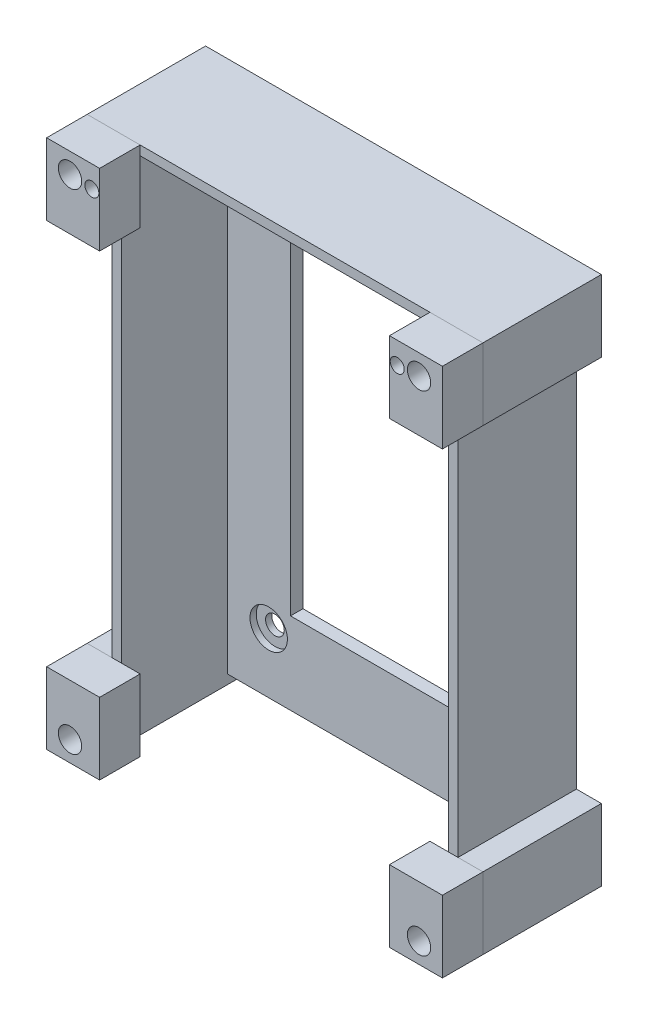
from build123d import *

# Parameters (mm, degrees)
SKETCH1_W           = 52.5
SKETCH1_H           = 82
SKETCH1_R           = 3
SKETCH1_W_2         = 32.25
SKETCH1_H_2         = 55.75
BOSS_EXTRUDE1_DEPTH = 2
SKETCH1_6_R         = 3
SKETCH1_6_R_2       = 1.5
BOSS_EXTRUDE4_DEPTH = 1
BOSS_EXTRUDE2_DEPTH = 19
BOSS_EXTRUDE3_START = 19
SKETCH1_5_W         = 3
SKETCH1_5_H         = 10
SKETCH1_5_H_2       = 1.5
SKETCH1_5_W_2       = 4
SKETCH1_5_H_3       = 11.5
BOSS_EXTRUDE3_DEPTH = 6.5
SKETCH7_R           = 1.125
SKETCH7_R_2         = 1.875
CUT_EXTRUDE6_DEPTH  = 4


with BuildPart() as part:
    # Sketch1 → Boss-Extrude1 (new body)
    with BuildSketch(Plane.XY):
        Rectangle(SKETCH1_W, SKETCH1_H)
        with Locations((19.625, 31.375)):
            Circle(SKETCH1_R, mode=Mode.SUBTRACT)
        with Locations((-19.625, 31.375)):
            Circle(SKETCH1_R, mode=Mode.SUBTRACT)
        with Locations((19.625, -31.375)):
            Circle(SKETCH1_R, mode=Mode.SUBTRACT)
        with Locations((-19.625, -31.375)):
            Circle(SKETCH1_R, mode=Mode.SUBTRACT)
        Rectangle(SKETCH1_W_2, SKETCH1_H_2, mode=Mode.SUBTRACT)
    extrude(amount=BOSS_EXTRUDE1_DEPTH)

    # Sketch1<6> → Boss-Extrude4 (add)
    # profile 1 of 4: a face of its own
    with BuildSketch(Plane.XY):
        with Locations((-19.625, 31.375)):
            Circle(SKETCH1_6_R)
        with Locations((-19.625, 31.375)):
            Circle(SKETCH1_6_R_2, mode=Mode.SUBTRACT)
    # profile 2 of 4: a face of its own
    with BuildSketch(Plane.XY):
        with Locations((19.625, 31.375)):
            Circle(SKETCH1_6_R)
        with Locations((19.625, 31.375)):
            Circle(SKETCH1_6_R_2, mode=Mode.SUBTRACT)
    # profile 3 of 4: a face of its own
    with BuildSketch(Plane.XY):
        with Locations((-19.625, -31.375)):
            Circle(SKETCH1_6_R)
        with Locations((-19.625, -31.375)):
            Circle(SKETCH1_6_R_2, mode=Mode.SUBTRACT)
    # profile 4 of 4: a face of its own
    with BuildSketch(Plane.XY):
        with Locations((19.625, -31.375)):
            Circle(SKETCH1_6_R)
        with Locations((19.625, -31.375)):
            Circle(SKETCH1_6_R_2, mode=Mode.SUBTRACT)
    extrude(amount=BOSS_EXTRUDE4_DEPTH)

    # Sketch1<4> → Boss-Extrude2 (add)
    with BuildSketch(Plane.XY):
        Polygon((-31.75, 42.5), (-31.75, 31), (-27.75, 31), (-27.75, -31), (-31.75, -31), (-31.75, -42.5), (-26.25, -42.5), (-26.25, 41), (26.25, 41), (26.25, -42.5), (31.75, -42.5), (31.75, -31), (27.75, -31), (27.75, 31), (31.75, 31), (31.75, 42.5), align=None)
    extrude(amount=BOSS_EXTRUDE2_DEPTH)


with BuildPart() as body_2:
    # Sketch1<5> → Boss-Extrude3 (new body)
    with BuildSketch(Plane.XY.offset(BOSS_EXTRUDE3_START)):
        Polygon((-23.25, 42.5), (-27.75, 42.5), (-27.75, 31), (-26.25, 31), (-26.25, 41), (-23.25, 41), align=None)
        with Locations((-24.75, 36)):
            Rectangle(SKETCH1_5_W, SKETCH1_5_H)
        with Locations((24.75, 36)):
            Rectangle(SKETCH1_5_W, SKETCH1_5_H)
        Polygon((27.75, 42.5), (23.25, 42.5), (23.25, 41), (26.25, 41), (26.25, 31), (27.75, 31), align=None)
        Polygon((27.75, -42.5), (27.75, -31), (26.25, -31), (26.25, -41), (26.25, -42.5), align=None)
        with Locations((24.75, -36)):
            Rectangle(SKETCH1_5_W, SKETCH1_5_H)
        with Locations((24.75, -41.75)):
            Rectangle(SKETCH1_5_W, SKETCH1_5_H_2)
        with Locations((-24.75, -41.75)):
            Rectangle(SKETCH1_5_W, SKETCH1_5_H_2)
        with Locations((-24.75, -36)):
            Rectangle(SKETCH1_5_W, SKETCH1_5_H)
        Polygon((-26.25, -31), (-27.75, -31), (-27.75, -42.5), (-26.25, -42.5), (-26.25, -41), align=None)
        with Locations((-29.75, 36.75)):
            Rectangle(SKETCH1_5_W_2, SKETCH1_5_H_3)
        with Locations((29.75, 36.75)):
            Rectangle(SKETCH1_5_W_2, SKETCH1_5_H_3)
        with Locations((29.75, -36.75)):
            Rectangle(SKETCH1_5_W_2, SKETCH1_5_H_3)
        with Locations((-29.75, -36.75)):
            Rectangle(SKETCH1_5_W_2, SKETCH1_5_H_3)
    extrude(amount=BOSS_EXTRUDE3_DEPTH)

    # Sketch7 → Cut-Extrude6 (cut)
    with BuildSketch(Plane.XY.offset(25.5)):
        with Locations((-24.5, 39)):
            Circle(SKETCH7_R)
        with Locations((-28, 39.25)):
            Circle(SKETCH7_R_2)
        with Locations((28, 39.25)):
            Circle(SKETCH7_R_2)
        with Locations((-28, -39.25)):
            Circle(SKETCH7_R_2)
        with Locations((28, -39.25)):
            Circle(SKETCH7_R_2)
        with Locations((24.5, 39)):
            Circle(SKETCH7_R)
    extrude(amount=-CUT_EXTRUDE6_DEPTH, mode=Mode.SUBTRACT)


solid = Compound([part.part, body_2.part])
